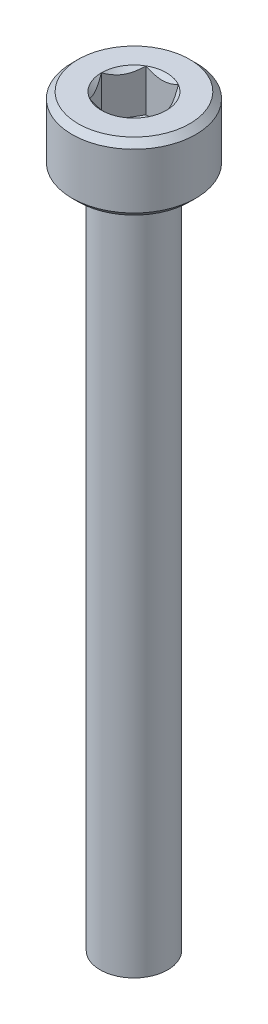
from build123d import *

# Parameters (mm, degrees)
SKETCH1_R           = 2.75
BOSS_EXTRUDE1_DEPTH = 3
CUT_EXTRUDE1_DEPTH  = 1.88
CHAMFER1_SIZE       = 0.275
SKETCH_1_R          = 1.5
EXTRUDE_1_DEPTH     = 30


with BuildPart() as part:
    # Sketch1 → Boss-Extrude1 (new body)
    with BuildSketch(Plane(origin=(0, 0, 0), x_dir=(1, 0, 0), z_dir=(0, 1, 0))):
        with Locations(Location((0, 0, 0), (0, 0, 270))):
            Circle(SKETCH1_R)
    extrude(amount=BOSS_EXTRUDE1_DEPTH)

    # Sketch2 → Cut-Extrude1 (cut)
    with BuildSketch(Plane(origin=(0, 3, 0), x_dir=(1, 0, 0), z_dir=(0, 1, 0))):
        Polygon((0.721687836, 1.25), (-0.721687836, 1.25), (-1.443375673, 0), (-0.721687836, -1.25), (0.721687836, -1.25), (1.443375673, 0), align=None)
    extrude(amount=-CUT_EXTRUDE1_DEPTH, mode=Mode.SUBTRACT)

    # Cut-Extrude2 cone 1 section (through the dimple's axis) → Cut-Extrude2 (revolve, cut)
    with BuildSketch(Plane(origin=(0, 3, 0), x_dir=(0, 0, 1), z_dir=(1, 0, 0))):
        Polygon((0, 0), (1.443375673, 0), (0, 1.443375673), align=None)
    revolve(axis=Axis((0, 3, 0), (0, -1, 0)), mode=Mode.SUBTRACT)

    # Chamfer1
    chamfer1_edges = [part.edges().sort_by_distance(p)[0] for p in [
        (0, 0, -2.75),
        (0, 3, -2.75),
    ]]
    chamfer(chamfer1_edges, length=CHAMFER1_SIZE)

    # 草图1 → 凸台-拉伸1 (add)
    with BuildSketch(Plane(origin=(0, 0, 0), x_dir=(-1, 0, 0), z_dir=(0, -1, 0))):
        with Locations(Location((0, 0, 0), (0, 0, 90))):
            Circle(SKETCH_1_R)
    extrude(amount=EXTRUDE_1_DEPTH)


solid = part.part
